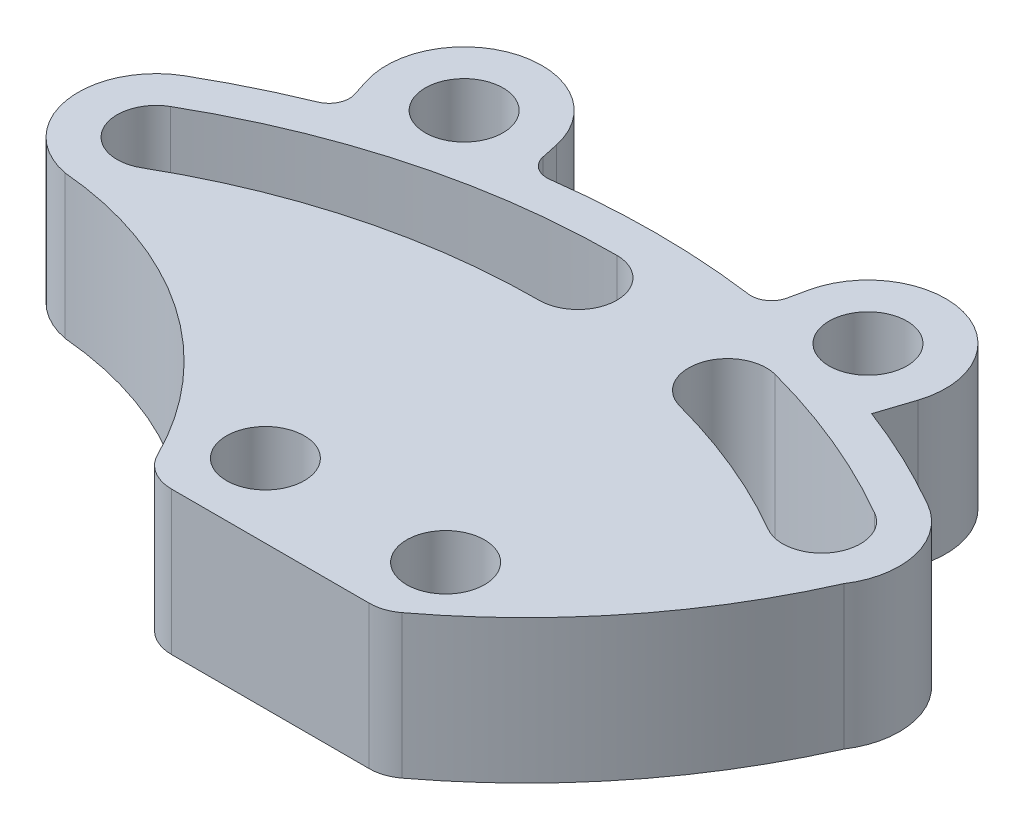
from build123d import *

# Parameters (mm, degrees)
SKETCH2_R           = 4.826
BOSS_EXTRUDE1_DEPTH = 17.78


with BuildPart() as part:
    # Sketch2 → Boss-Extrude1 (new body)
    with BuildSketch(Plane(origin=(0, 0, 0), x_dir=(1, 0, 0), z_dir=(0, 1, 0))):
        with BuildLine():
            ThreePointArc((15.610859978, 51.056586824), (27.545075694, 58.349621989), (34.233892096, 46.066560407))
            Line((34.233892096, 46.066560407), (32.812957113, 41.715646574))
            ThreePointArc((32.812957113, 41.715646574), (39.58316936, 38.822933823), (46.101, 35.39927428))
            ThreePointArc((46.101, 35.39927428), (50.667182056, 29.264811664), (49.337445304, 21.733978355))
            ThreePointArc((49.337445304, 21.733978355), (39.143444972, 4.93100158), (25.060604801, -8.777801578))
            ThreePointArc((25.060604801, -8.777801578), (23.616284404, -9.536863302), (22.005826143, -9.798894416))
            Line((22.005826143, -9.798894416), (-2.51457971, -9.798894416))
            ThreePointArc((-2.51457971, -9.798894416), (-5.192160007, -9.035949402), (-7.065470014, -6.976281719))
            ThreePointArc((-7.065470014, -6.976281719), (-21.858610455, 10.006362304), (-43.076963776, 17.558096172))
            ThreePointArc((-43.076963776, 17.558096172), (-50.791269491, 25.427412588), (-46.101, 35.39927428))
            ThreePointArc((-46.101, 35.39927428), (-40.648214467, 38.308271276), (-35.012800321, 40.845443124))
            ThreePointArc((-35.012800321, 40.845443124), (-33.673672112, 42.125267238), (-33.559725058, 43.974112877))
            Line((-33.559725058, 43.974112877), (-34.233892096, 46.066560407))
            ThreePointArc((-34.233892096, 46.066560407), (-27.545075694, 58.349621989), (-15.610859978, 51.056586824))
            Line((-15.610859978, 51.056586824), (-15.148481995, 48.907390587))
            ThreePointArc((-15.148481995, 48.907390587), (-14.125378132, 47.363216824), (-12.325747026, 46.924420733))
            ThreePointArc((-12.325747026, 46.924420733), (0, 47.752), (12.325747026, 46.924420733))
            ThreePointArc((12.325747026, 46.924420733), (14.125378132, 47.363216824), (15.148481995, 48.907390587))
            Line((15.148481995, 48.907390587), (15.610859978, 51.056586824))
        make_face()
        with Locations(Location((0, -0.668228959, 0), (0, 0, 270))):
            Circle(SKETCH2_R, mode=Mode.SUBTRACT)
        with Locations(Location((22.352, -0.668228959, 0), (0, 0, 270))):
            Circle(SKETCH2_R, mode=Mode.SUBTRACT)
        with Locations(Location((-25.046954271, 49.026505913, 0), (0, 0, 270))):
            Circle(SKETCH2_R, mode=Mode.SUBTRACT)
        with Locations(Location((25.046954271, 49.026505913, 0), (0, 0, 270))):
            Circle(SKETCH2_R, mode=Mode.SUBTRACT)
        with BuildLine():
            ThreePointArc((-43.688, 31.219835681), (-45.454438599, 24.627397082), (-38.862, 22.860958484))
            ThreePointArc((-38.862, 22.860958484), (-20.116451462, 30.625618922), (0, 33.274))
            ThreePointArc((0, 33.274), (4.826, 38.1), (0, 42.926))
            ThreePointArc((0, 42.926), (-22.614572885, 39.948734998), (-43.688, 31.219835681))
        make_face(mode=Mode.SUBTRACT)
        with BuildLine():
            ThreePointArc((22.614572885, 39.948734998), (16.703954136, 36.536237672), (20.116451462, 30.625618922))
            ThreePointArc((20.116451462, 30.625618922), (29.743687097, 27.357612785), (38.862, 22.860958484))
            ThreePointArc((38.862, 22.860958484), (45.454438599, 24.627397082), (43.688, 31.219835681))
            ThreePointArc((43.688, 31.219835681), (33.437347586, 36.274898033), (22.614572885, 39.948734998))
        make_face(mode=Mode.SUBTRACT)
    extrude(amount=BOSS_EXTRUDE1_DEPTH)


solid = part.part
